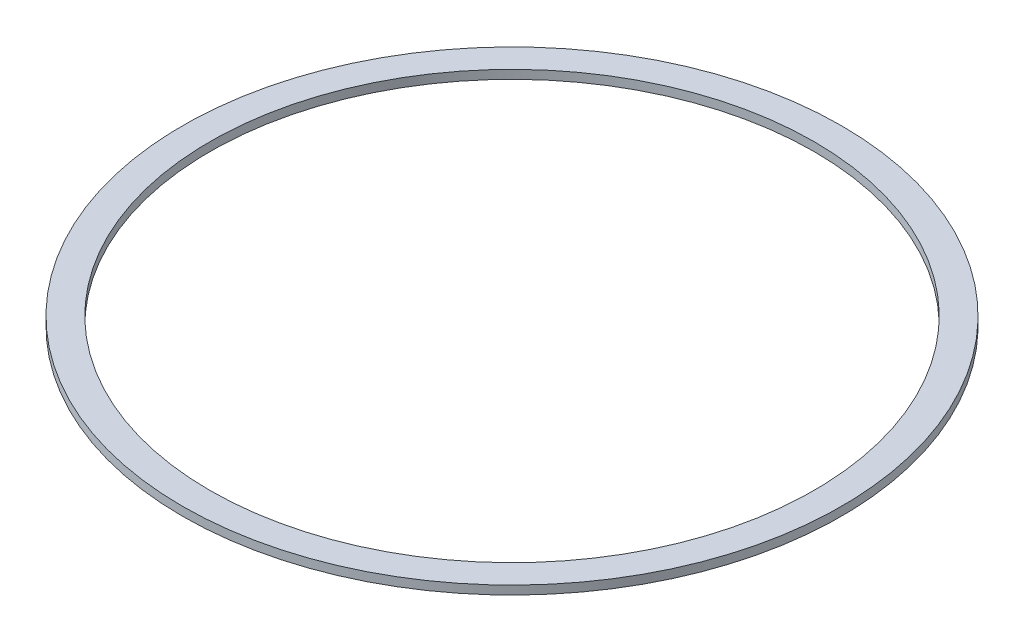
from build123d import *

# Parameters (mm, degrees)
SKETCH1_R           = 76.2
SKETCH1_R_2         = 69.85
BOSS_EXTRUDE1_DEPTH = 2


with BuildPart() as part:
    # Sketch1 → Boss-Extrude1 (new body)
    with BuildSketch(Plane(origin=(0, 0, 0), x_dir=(1, 0, 0), z_dir=(0, 1, 0))):
        with Locations(Location((0, 0, 0), (0, 0, 270))):
            Circle(SKETCH1_R)
        with Locations(Location((0, 0, 0), (0, 0, 270))):
            Circle(SKETCH1_R_2, mode=Mode.SUBTRACT)
    extrude(amount=BOSS_EXTRUDE1_DEPTH)


solid = part.part
